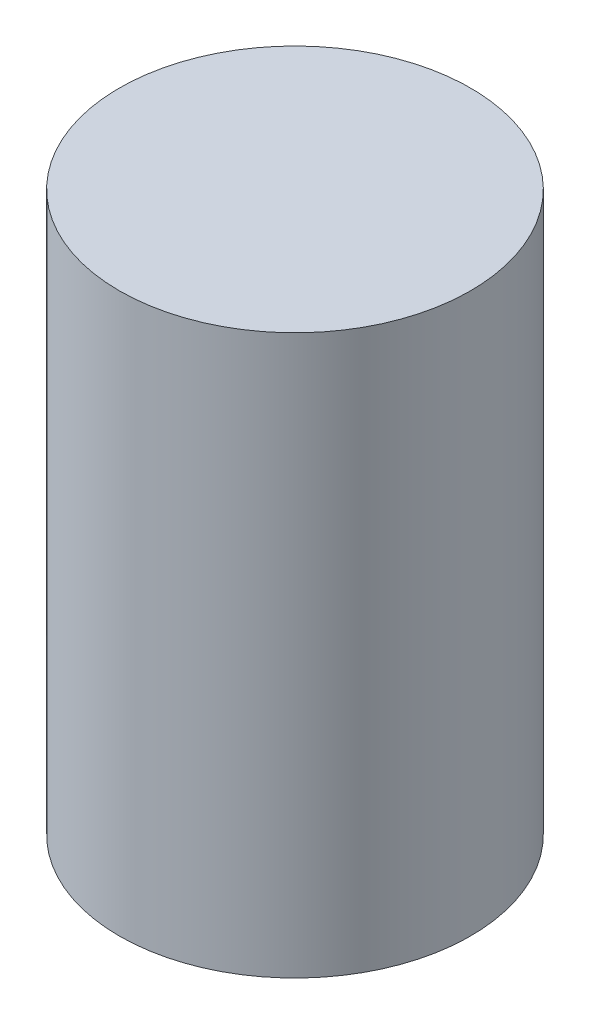
from build123d import *

# Parameters (mm, degrees)
KOLA330_GOVDE_D66_START = 3
SKETCH1_R               = 33
KOLA330_GOVDE_D66_DEPTH = 105


with BuildPart() as part:
    # Sketch1 → KOLA330_govde_D66 (new body)
    with BuildSketch(Plane(origin=(0, 0, 0), x_dir=(1, 0, 0), z_dir=(0, 1, 0)).offset(KOLA330_GOVDE_D66_START)):
        with Locations(Location((0, 0, 0), (0, 0, 270))):
            Circle(SKETCH1_R)
    extrude(amount=KOLA330_GOVDE_D66_DEPTH)


solid = part.part
